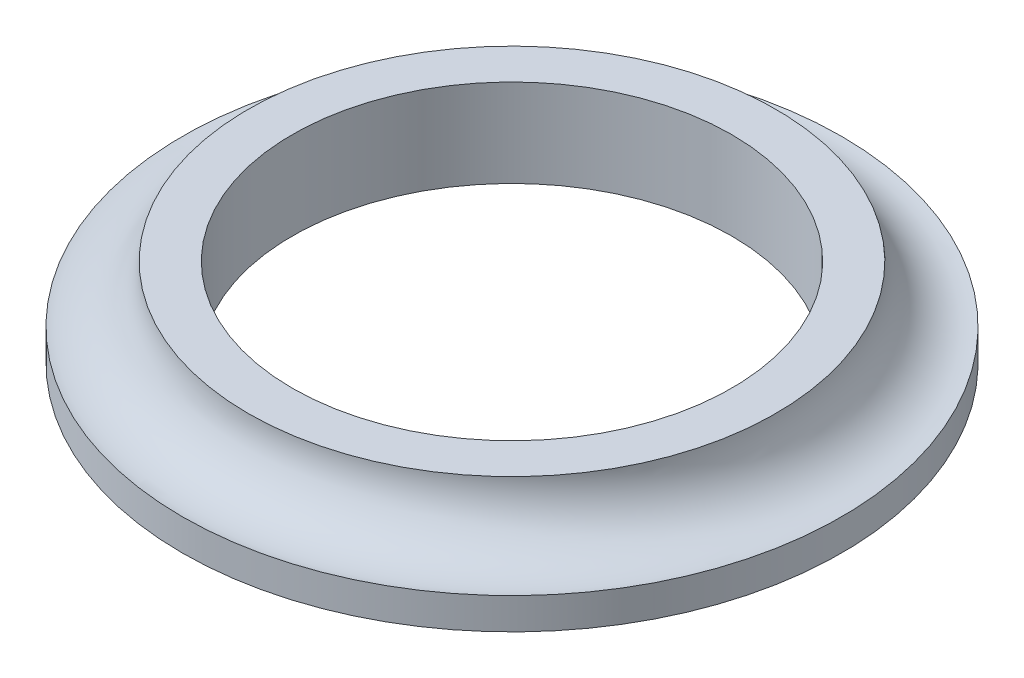
from build123d import *


with BuildPart() as part:
    # Sketch1 → Revolve1 (revolve)
    with BuildSketch(Plane(origin=(0, 0, 0), x_dir=(0, 0, -1), z_dir=(1, 0, 0))):
        with BuildLine():
            Line((-25, 5.423893873), (-25, -4.576106127))
            Line((-25, -4.576106127), (-37.5, -4.576106127))
            Line((-37.5, -4.576106127), (-37.5, -0.998722416))
            ThreePointArc((-37.5, -0.998722416), (-32.272116369, 0.486789459), (-30, 5.423893873))
            Line((-30, 5.423893873), (-25, 5.423893873))
        make_face()
    revolve(axis=Axis((0, 212.009913499, 0), (0, -1, 0)))


solid = part.part
